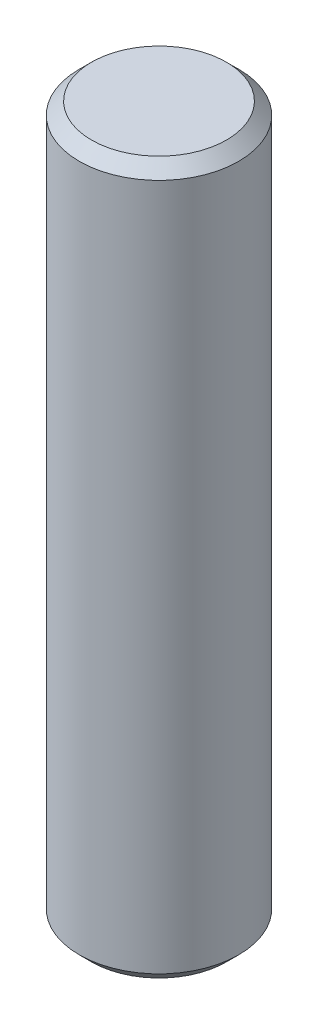
from build123d import *

# Parameters (mm, degrees)
SKETCH1_R           = 1.651
BOSS_EXTRUDE1_DEPTH = 14.732
CHAMFER1_SIZE       = 0.254


with BuildPart() as part:
    # Sketch1 → Boss-Extrude1 (new body)
    with BuildSketch(Plane(origin=(0, 0, 0), x_dir=(1, 0, 0), z_dir=(0, 1, 0))):
        with Locations(Location((0, 0, 0), (0, 0, 270))):
            Circle(SKETCH1_R)
    extrude(amount=BOSS_EXTRUDE1_DEPTH)

    # Chamfer1
    chamfer1_edges = [part.edges().sort_by_distance(p)[0] for p in [
        (0, 0, -1.651),
        (0, 14.732, -1.651),
    ]]
    chamfer(chamfer1_edges, length=CHAMFER1_SIZE)


solid = part.part
